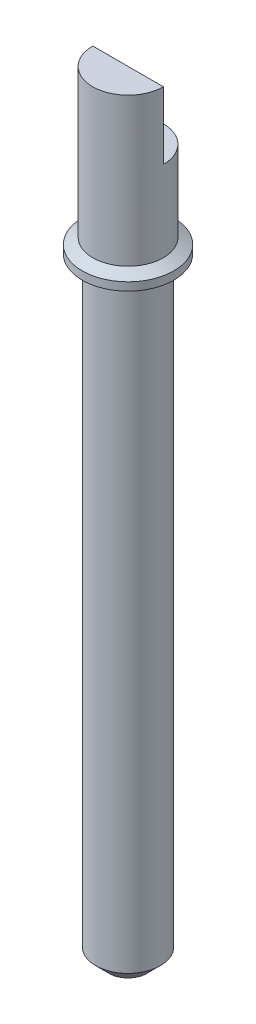
from build123d import *

# Parameters (mm, degrees)
CUT_EXTRUDE1_START = -1.25
CUT_EXTRUDE1_DEPTH = 1.25


with BuildPart() as part:
    # Sketch1 → Revolve1 (revolve)
    with BuildSketch(Plane.XY):
        Polygon((0.6, 24.386414327), (0.6, 13.386414327), (0.35, 13.136414327), (0, 13.136414327), (0, 27.543335196), (0.655, 27.543335196), (0.655, 24.793335196), (0.85, 24.680751894), (0.85, 24.530751894), align=None)
    revolve(axis=Axis((0, 0, 0), (0, 1, 0)))

    # Sketch2 → Cut-Extrude1 (cut)
    with BuildSketch(Plane(origin=(0, 27.543335196, 0), x_dir=(-1, 0, 0), z_dir=(0, 1, 0)).offset(CUT_EXTRUDE1_START)):
        with BuildLine():
            Line((-0.655, 0), (0.655, 0))
            ThreePointArc((0.655, 0), (0, -0.655), (-0.655, 0))
        make_face()
    extrude(amount=CUT_EXTRUDE1_DEPTH, mode=Mode.SUBTRACT)


solid = part.part
